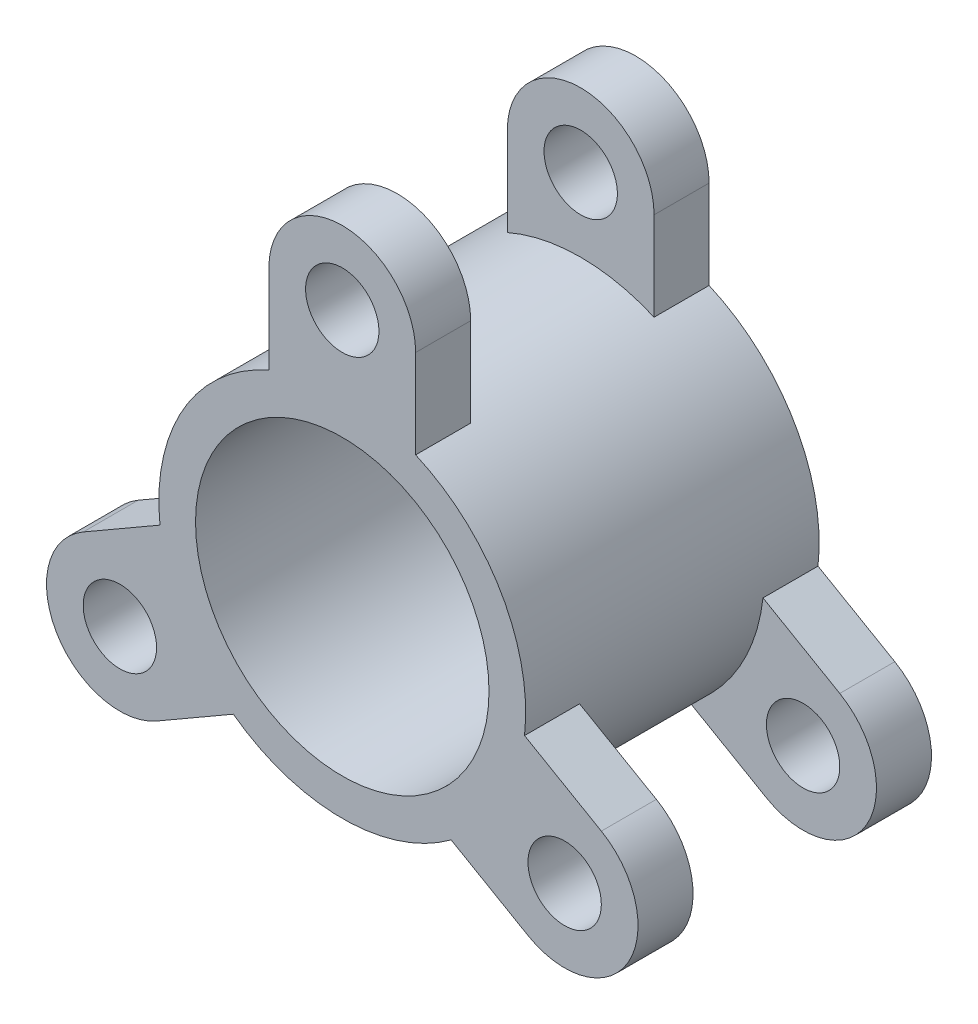
from build123d import *

# Parameters (mm, degrees)
SKETCH1_R           = 50
SKETCH1_R_2         = 40
SKETCH1_R_3         = 10
BOSS_EXTRUDE1_DEPTH = 80
SKETCH6_W           = 60
SKETCH6_H           = 50


with BuildPart() as part:
    # Sketch1 → Boss-Extrude1 (new body)
    # profile 1 of 4: a face of its own
    with BuildSketch(Plane.XY):
        Circle(SKETCH1_R)
        Circle(SKETCH1_R_2, mode=Mode.SUBTRACT)
    # profile 2 of 4: a face of its own
    with BuildSketch(Plane.XY):
        with BuildLine():
            ThreePointArc((20, 70), (0, 90), (-20, 70))
            Line((-20, 70), (-20, 45.82575695))
            ThreePointArc((-20, 45.82575695), (0, 50), (20, 45.82575695))
            Line((20, 45.82575695), (20, 70))
        make_face()
        with Locations((0, 70)):
            Circle(SKETCH1_R_3, mode=Mode.SUBTRACT)
    # profile 3 of 4: a face of its own
    with BuildSketch(Plane.XY):
        with BuildLine():
            ThreePointArc((-29.686269666, -40.23338655), (-43.301270189, -25), (-49.686269666, -5.592370399))
            Line((-49.686269666, -5.592370399), (-70.621778265, -17.679491924))
            ThreePointArc((-70.621778265, -17.679491924), (-77.942286341, -45), (-50.621778265, -52.320508076))
            Line((-50.621778265, -52.320508076), (-29.686269666, -40.23338655))
        make_face()
        with Locations((-60.621778265, -35)):
            Circle(SKETCH1_R_3, mode=Mode.SUBTRACT)
    # profile 4 of 4: a face of its own
    with BuildSketch(Plane.XY):
        with BuildLine():
            Line((70.621778265, -17.679491924), (49.686269666, -5.592370399))
            ThreePointArc((49.686269666, -5.592370399), (43.301270189, -25), (29.686269666, -40.23338655))
            Line((29.686269666, -40.23338655), (50.621778265, -52.320508076))
            ThreePointArc((50.621778265, -52.320508076), (77.942286341, -45), (70.621778265, -17.679491924))
        make_face()
        with Locations((60.621778265, -35)):
            Circle(SKETCH1_R_3, mode=Mode.SUBTRACT)
    extrude(amount=BOSS_EXTRUDE1_DEPTH)

    # Sketch6 → Cut-Revolve1 (revolve, cut)
    with BuildSketch(Plane(origin=(0, 0, 0), x_dir=(-0.8660254037844385, -0.5000000000000004, 0), z_dir=(0.5000000000000003, -0.8660254037844384, 0)), mode=Mode.PRIVATE) as cut_revolve1_sk:
        with Locations((80, -40)):
            Rectangle(SKETCH6_W, SKETCH6_H)
    revolve(cut_revolve1_sk.sketch.rotate(Axis((0, 0, 80), (0, 0, -1)), 23.578178478), axis=Axis((0, 0, 80), (0, 0, -1)), mode=Mode.SUBTRACT)


solid = part.part
